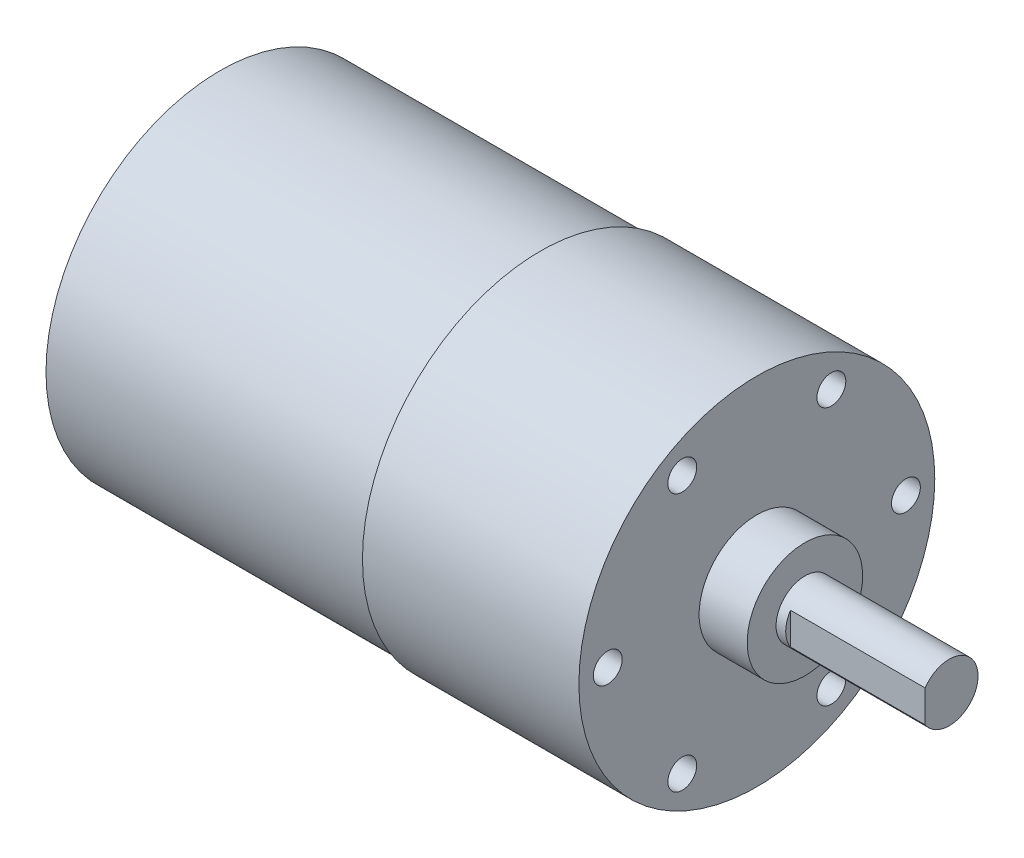
from build123d import *

# Parameters (mm, degrees)
SKETCH1_R               = 18.5
BOSS_EXTRUDE1_DEPTH     = 22.5
SKETCH2_R               = 6
BOSS_EXTRUDE2_DEPTH     = 5
SKETCH3_R               = 3
BOSS_EXTRUDE3_DEPTH     = 15
CUT_EXTRUDE1_DEPTH      = 50.907414279
CUT_EXTRUDE1_DEPTH_BACK = 14
SKETCH5_R               = 18.1
BOSS_EXTRUDE4_DEPTH     = 33.3
SKETCH6_W               = 1.743362505
SKETCH6_H               = 9.378087958
SKETCH6_W_2             = 1.863594402
BOSS_EXTRUDE5_DEPTH     = 4
SKETCH7_R               = 1.5
CUT_EXTRUDE2_DEPTH      = 5


with BuildPart() as part:
    # Sketch1 → Boss-Extrude1 (new body)
    with BuildSketch(Plane.YZ):
        with Locations(Location((0, 0, 0), (0, 0, 90))):
            Circle(SKETCH1_R)
    extrude(amount=BOSS_EXTRUDE1_DEPTH)

    # Sketch2 → Boss-Extrude2 (add)
    with BuildSketch(Plane.YZ.offset(22.5)):
        with Locations(Location((0, 0, 0), (0, 0, 270))):
            Circle(SKETCH2_R)
    extrude(amount=BOSS_EXTRUDE2_DEPTH)

    # Sketch3 → Boss-Extrude3 (add)
    with BuildSketch(Plane.YZ.offset(27.5)):
        with Locations(Location((0, 0, 0), (0, 0, 270))):
            Circle(SKETCH3_R)
    extrude(amount=BOSS_EXTRUDE3_DEPTH)

    # Sketch4 → Cut-Extrude1 (cut, two sides: drawn at the far end of the back side and taken through both)
    with BuildSketch(Plane.YZ.offset(42.5).offset(-CUT_EXTRUDE1_DEPTH_BACK)):
        Polygon((-69.877125802, 2.5), (-1.658312395, 2.5), (1.658312395, 2.5), (69.877125802, 2.5), (69.877125802, 138.937626813), (-69.877125802, 138.937626813), align=None)
    extrude(amount=CUT_EXTRUDE1_DEPTH + CUT_EXTRUDE1_DEPTH_BACK, mode=Mode.SUBTRACT)

    # Sketch5 → Boss-Extrude4 (add)
    with BuildSketch(Plane(origin=(0, 0, 0), x_dir=(0, -1, 0), z_dir=(-1, 0, 0))):
        with Locations(Location((0, 0, 0), (0, 0, 90))):
            Circle(SKETCH5_R)
    extrude(amount=BOSS_EXTRUDE4_DEPTH)

    # Sketch6 → Boss-Extrude5 (add)
    with BuildSketch(Plane(origin=(-33.3, 0, 0), x_dir=(0, -1, 0), z_dir=(-1, 0, 0))):
        with Locations((-5.801189026, 0.510985562)):
            Rectangle(SKETCH6_W, SKETCH6_H)
        with Locations((6.041652819, 0.510985562)):
            Rectangle(SKETCH6_W_2, SKETCH6_H)
    extrude(amount=BOSS_EXTRUDE5_DEPTH)

    # Sketch7 → Cut-Extrude2 (cut)
    with BuildSketch(Plane.YZ.offset(22.5)):
        with Locations(Location((0, 15.5, 0), (0, 0, 270))):
            Circle(SKETCH7_R)
        with Locations(Location((13.423393759, 7.75, 0), (0, 0, 270))):
            Circle(SKETCH7_R)
        with Locations(Location((13.423393759, -7.75, 0), (0, 0, 270))):
            Circle(SKETCH7_R)
        with Locations(Location((0, -15.5, 0), (0, 0, 270))):
            Circle(SKETCH7_R)
        with Locations(Location((-13.423393759, -7.75, 0), (0, 0, 270))):
            Circle(SKETCH7_R)
        with Locations(Location((-13.423393759, 7.75, 0), (0, 0, 270))):
            Circle(SKETCH7_R)
    extrude(amount=-CUT_EXTRUDE2_DEPTH, mode=Mode.SUBTRACT)


solid = part.part
